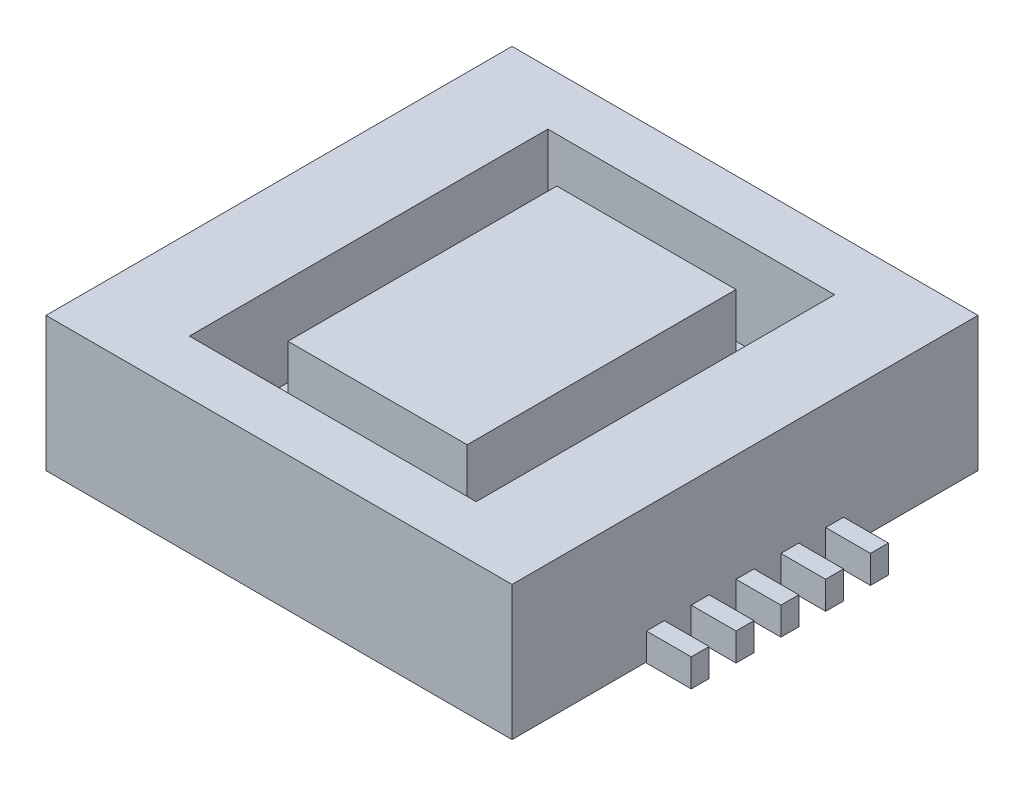
from build123d import *

# Parameters (mm, degrees)
SKETCH_1_W                 = 5.2
SKETCH_1_H                 = 5.2
EXTRUDE_1_DEPTH            = 1.5
SKETCH_2_W                 = 3.2
SKETCH_2_H                 = 4
SKETCH_2_W_2               = 2
SKETCH_2_H_2               = 3
CUT_EXTRUDE_1_DEPTH        = 1
EXTRUDE_START              = -0.01
SKETCH_3_W                 = 2.7
SKETCH_3_H                 = 0.2
EXTRUDE_2_DEPTH            = 0.31
PATTERN_LINEAR_1_COUNT     = 3
PATTERN_LINEAR_1_PITCH     = 0.5
PATTERN_LINEAR_1_COL_COUNT = 3
PATTERN_LINEAR_1_COL_PITCH = 0.5
MIRROR_START               = -0.01
MIRROR_1_COPY_1_SKETCH_W   = 2.7
MIRROR_1_COPY_1_SKETCH_H   = 0.2
MIRROR_1_COPY_1_DEPTH      = 0.31
MIRROR_1_COPY_2_SKETCH_W   = 2.7
MIRROR_1_COPY_2_SKETCH_H   = 0.2
MIRROR_1_COPY_2_DEPTH      = 0.31
MIRROR_1_COPY_3_SKETCH_W   = 2.7
MIRROR_1_COPY_3_SKETCH_H   = 0.2
MIRROR_1_COPY_3_DEPTH      = 0.31
MIRROR_1_COPY_4_SKETCH_W   = 2.7
MIRROR_1_COPY_4_SKETCH_H   = 0.2
MIRROR_1_COPY_4_DEPTH      = 0.31


with BuildPart() as part:
    # Эскиз1 → Бобышка-Вытянуть1 (new body)
    with BuildSketch(Plane(origin=(0, 0, 0), x_dir=(1, 0, 0), z_dir=(0, 1, 0))):
        Rectangle(SKETCH_1_W, SKETCH_1_H)
    extrude(amount=EXTRUDE_1_DEPTH)

    # Эскиз2 → Вырез-Вытянуть1 (cut)
    with BuildSketch(Plane(origin=(0, 1.5, 0), x_dir=(1, 0, 0), z_dir=(0, 1, 0))):
        Rectangle(SKETCH_2_W, SKETCH_2_H)
        Rectangle(SKETCH_2_W_2, SKETCH_2_H_2, mode=Mode.SUBTRACT)
    extrude(amount=-CUT_EXTRUDE_1_DEPTH, mode=Mode.SUBTRACT)

    # Эскиз3 → Бобышка-Вытянуть2 (add)
    with BuildSketch(Plane(origin=(0, 0, 0), x_dir=(1, 0, 0), z_dir=(0, 1, 0)).offset(EXTRUDE_START)):
        with Locations((-1.75, 0)):
            Rectangle(SKETCH_3_W, SKETCH_3_H)
    extrude_2 = extrude(amount=EXTRUDE_2_DEPTH)

    # Линейный массив1: Бобышка-Вытянуть2 ×3
    with Locations(*[(0, 0, -i * PATTERN_LINEAR_1_PITCH) for i in range(1, PATTERN_LINEAR_1_COUNT)]):
        add(extrude_2)

    # Линейный массив1 col: Бобышка-Вытянуть2 ×3
    with Locations(*[(0, 0, i * PATTERN_LINEAR_1_COL_PITCH) for i in range(1, PATTERN_LINEAR_1_COL_COUNT)]):
        add(extrude_2)

    # Зеркальное отражение1: Бобышка-Вытянуть2 across plane
    add(extrude_2.mirror(Plane(origin=(0, 0, 0), x_dir=(0, 0, 1), z_dir=(1, 0, 0))))

    # Зеркальное отражение1 copy 1 sketch → Зеркальное отражение1 copy 1 (add)
    with BuildSketch(Plane(origin=(0, 0, -0.5), x_dir=(-1, 0, 0), z_dir=(0, 1, 0)).offset(MIRROR_START)):
        with Locations((-1.75, 0)):
            Rectangle(MIRROR_1_COPY_1_SKETCH_W, MIRROR_1_COPY_1_SKETCH_H)
    extrude(amount=MIRROR_1_COPY_1_DEPTH)

    # Зеркальное отражение1 copy 2 sketch → Зеркальное отражение1 copy 2 (add)
    with BuildSketch(Plane(origin=(0, 0, -1), x_dir=(-1, 0, 0), z_dir=(0, 1, 0)).offset(MIRROR_START)):
        with Locations((-1.75, 0)):
            Rectangle(MIRROR_1_COPY_2_SKETCH_W, MIRROR_1_COPY_2_SKETCH_H)
    extrude(amount=MIRROR_1_COPY_2_DEPTH)

    # Зеркальное отражение1 copy 3 sketch → Зеркальное отражение1 copy 3 (add)
    with BuildSketch(Plane(origin=(0, 0, 0.5), x_dir=(-1, 0, 0), z_dir=(0, 1, 0)).offset(MIRROR_START)):
        with Locations((-1.75, 0)):
            Rectangle(MIRROR_1_COPY_3_SKETCH_W, MIRROR_1_COPY_3_SKETCH_H)
    extrude(amount=MIRROR_1_COPY_3_DEPTH)

    # Зеркальное отражение1 copy 4 sketch → Зеркальное отражение1 copy 4 (add)
    with BuildSketch(Plane(origin=(0, 0, 1), x_dir=(-1, 0, 0), z_dir=(0, 1, 0)).offset(MIRROR_START)):
        with Locations((-1.75, 0)):
            Rectangle(MIRROR_1_COPY_4_SKETCH_W, MIRROR_1_COPY_4_SKETCH_H)
    extrude(amount=MIRROR_1_COPY_4_DEPTH)


solid = part.part
